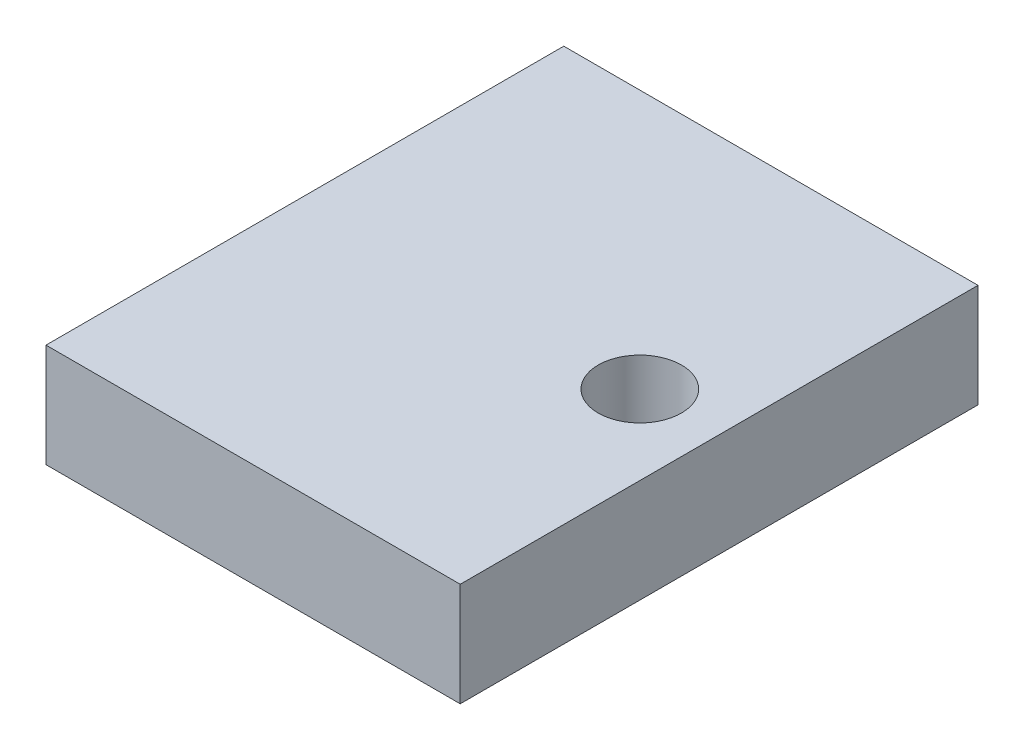
from build123d import *

# Parameters (mm, degrees)
SKETCH2_W                   = 25.4
SKETCH2_H                   = 31.75
BOSS_EXTRUDE1_DEPTH         = 6.35
F_1_4_20_TAPPED_HOLE1_D     = 5.1054
F_1_4_20_TAPPED_HOLE1_DEPTH = 19.05
F_1_4_20_TAPPED_HOLE1_TIP   = 1.533816902


with BuildPart() as part:
    # Sketch2 → Boss-Extrude1 (new body)
    with BuildSketch(Plane(origin=(0, 0, 0), x_dir=(1, 0, 0), z_dir=(0, 1, 0))):
        with Locations((12.7, 15.875)):
            Rectangle(SKETCH2_W, SKETCH2_H)
    extrude(amount=BOSS_EXTRUDE1_DEPTH)

    # 1/4-20 Tapped Hole1
    with Locations(Plane(origin=(20.539202, 6.35, -15.875), x_dir=(0, 0, 1), z_dir=(0, 1, 0))):
        with Locations((0, 0)):
            Hole(F_1_4_20_TAPPED_HOLE1_D / 2, depth=F_1_4_20_TAPPED_HOLE1_DEPTH)
            with Locations((0, 0, -(F_1_4_20_TAPPED_HOLE1_DEPTH + F_1_4_20_TAPPED_HOLE1_TIP / 2))):  # 118° drill point
                Cone(0, F_1_4_20_TAPPED_HOLE1_D / 2, F_1_4_20_TAPPED_HOLE1_TIP, mode=Mode.SUBTRACT)


solid = part.part
